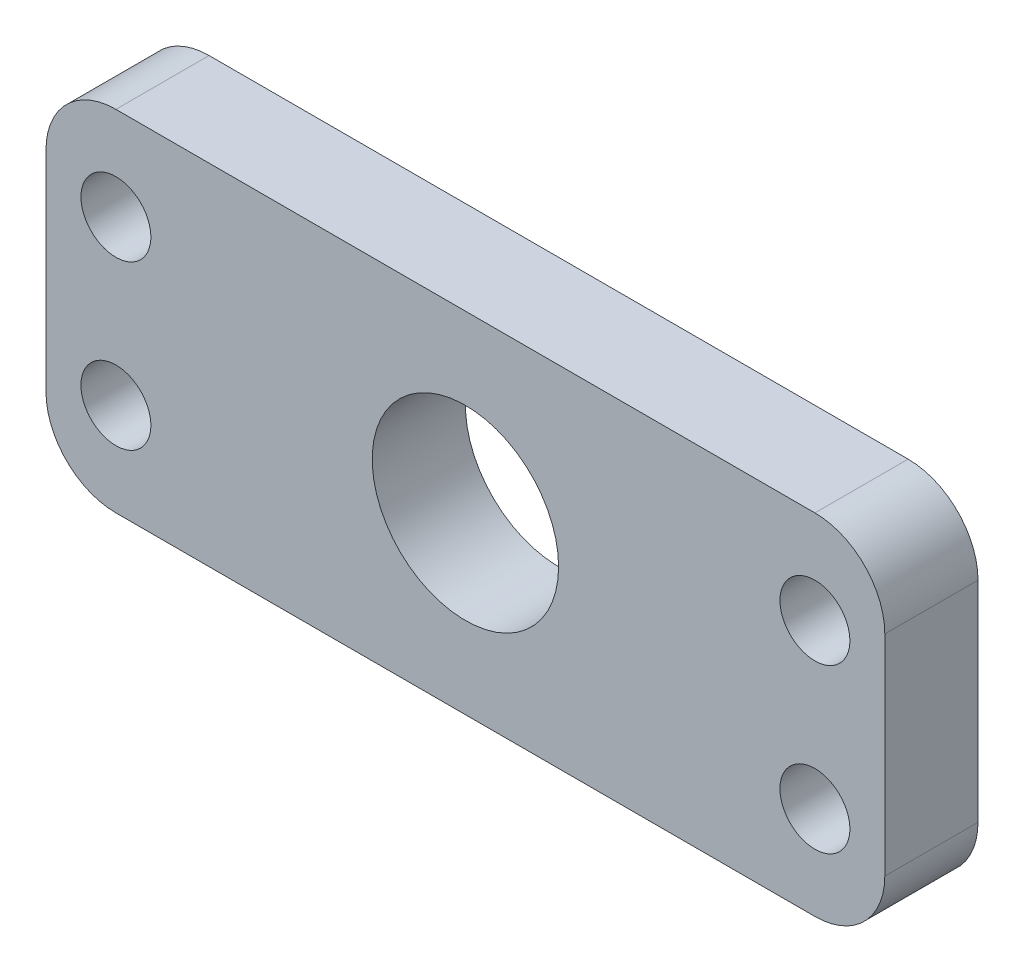
from build123d import *

# Parameters (mm, degrees)
SKETCH_1_W          = 36
SKETCH_1_H          = 15
EXTRUDE_1_DEPTH     = 4
SKETCH_2_R          = 4
CUT_EXTRUDE_1_DEPTH = 20.906029237
SKETCH_4_R          = 1.5
CUT_EXTRUDE_2_DEPTH = 20.906029237
FILLET_1_R          = 3


with BuildPart() as part:
    # 草图1 → 凸台-拉伸1 (new body)
    with BuildSketch(Plane.XY):
        Rectangle(SKETCH_1_W, SKETCH_1_H)
    extrude(amount=EXTRUDE_1_DEPTH)

    # 草图2 → 切除-拉伸1 (cut, through all)
    with BuildSketch(Plane.XY.offset(4)):
        Circle(SKETCH_2_R)
    extrude(amount=-CUT_EXTRUDE_1_DEPTH, mode=Mode.SUBTRACT)

    # 草图4 → 切除-拉伸2 (cut, through all)
    with BuildSketch(Plane(origin=(0, 0, 0), x_dir=(-1, 0, 0), z_dir=(0, 0, -1))):
        with Locations((15, -3.5)):
            Circle(SKETCH_4_R)
        with Locations((15, 3.5)):
            Circle(SKETCH_4_R)
        with Locations((-15, 3.5)):
            Circle(SKETCH_4_R)
        with Locations((-15, -3.5)):
            Circle(SKETCH_4_R)
    extrude(amount=-CUT_EXTRUDE_2_DEPTH, mode=Mode.SUBTRACT)

    # 圆角1
    fillet_1_edges = [part.edges().sort_by_distance(p)[0] for p in [
        (-18, 7.5, 2),
        (18, 7.5, 2),
        (18, -7.5, 2),
        (-18, -7.5, 2),
    ]]
    fillet(fillet_1_edges, radius=FILLET_1_R)


solid = part.part
